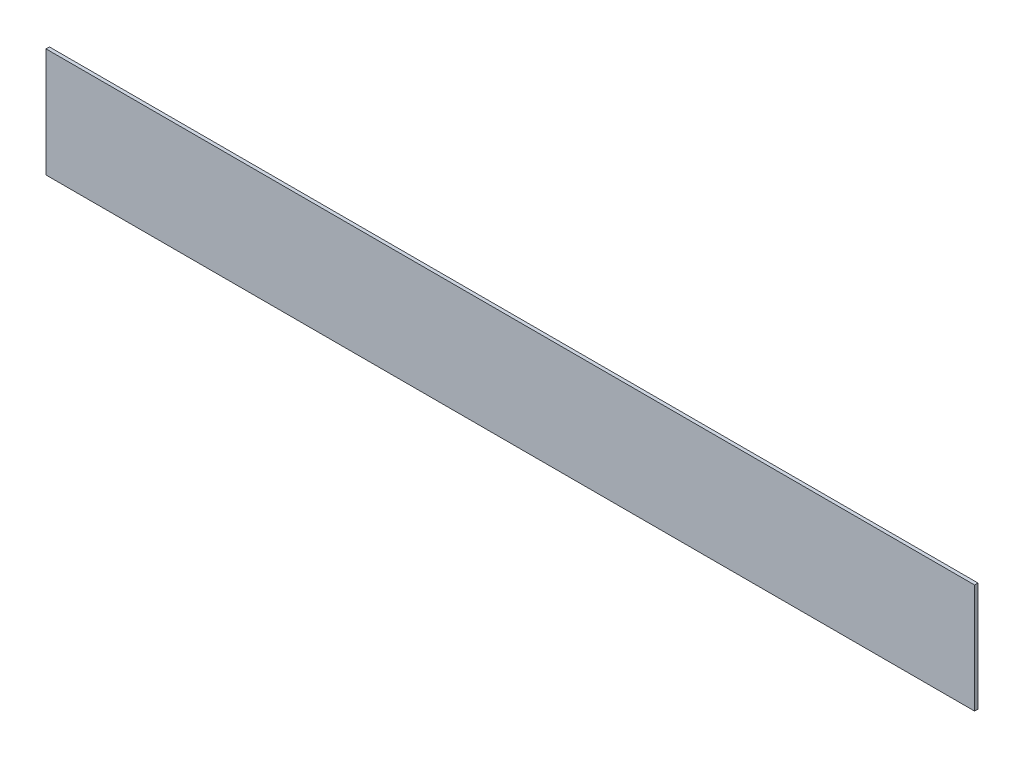
from build123d import *

# Parameters (mm, degrees)
SKETCH2_W           = 431.8
SKETCH2_H           = 50.8
BOSS_EXTRUDE1_DEPTH = 1.5875


with BuildPart() as part:
    # Sketch2 → Boss-Extrude1 (new body)
    with BuildSketch(Plane.XY):
        with Locations((215.9, 25.4)):
            Rectangle(SKETCH2_W, SKETCH2_H)
    extrude(amount=BOSS_EXTRUDE1_DEPTH)


solid = part.part
